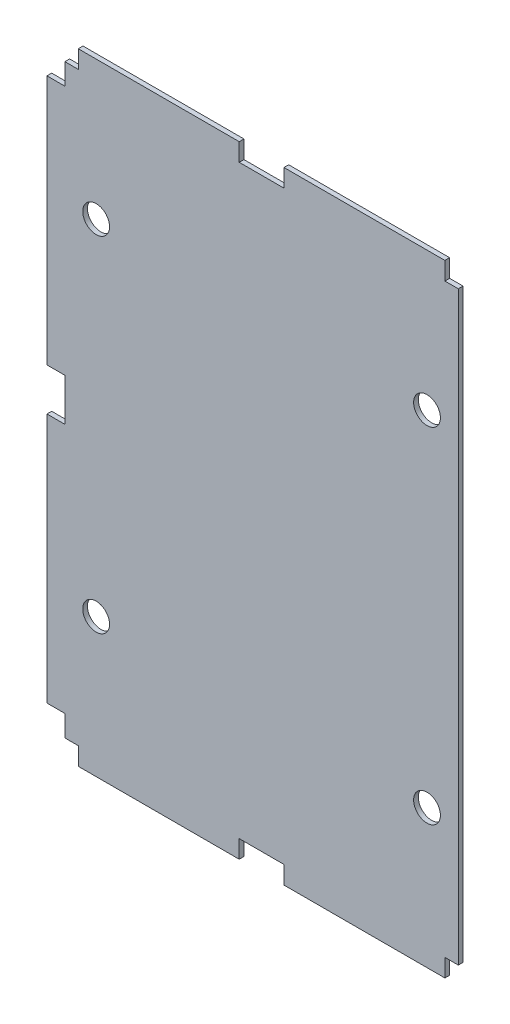
from build123d import *

# Parameters (mm, degrees)
SKETCH1_W           = 279.4
SKETCH1_H           = 415.925
SKETCH1_R           = 9.525
SKETCH1_W_2         = 12.7
SKETCH1_H_2         = 177.8
SKETCH1_W_3         = 114.3
SKETCH1_H_3         = 12.7
BOSS_EXTRUDE3_DEPTH = 3.3528


with BuildPart() as part:
    # Sketch1 → Boss-Extrude3 (new body)
    # profile 1 of 7: a face of its own
    with BuildSketch(Plane.XY):
        Rectangle(SKETCH1_W, SKETCH1_H)
        with Locations((117.475, -122.2375)):
            Circle(SKETCH1_R, mode=Mode.SUBTRACT)
        with Locations((117.475, 122.2375)):
            Circle(SKETCH1_R, mode=Mode.SUBTRACT)
        with Locations((-117.475, -122.2375)):
            Circle(SKETCH1_R, mode=Mode.SUBTRACT)
        with Locations((-117.475, 122.2375)):
            Circle(SKETCH1_R, mode=Mode.SUBTRACT)
    # profile 2 of 7: a face of its own
    with BuildSketch(Plane.XY):
        with Locations((-146.05, 103.98125)):
            Rectangle(SKETCH1_W_2, SKETCH1_H_2)
    # profile 3 of 7: a face of its own
    with BuildSketch(Plane.XY):
        with Locations((-73.025, 214.3125)):
            Rectangle(SKETCH1_W_3, SKETCH1_H_3)
    # profile 4 of 7: a face of its own
    with BuildSketch(Plane.XY):
        with Locations((-146.05, -103.98125)):
            Rectangle(SKETCH1_W_2, SKETCH1_H_2)
    # profile 5 of 7: a face of its own
    with BuildSketch(Plane.XY):
        with Locations((73.025, 214.3125)):
            Rectangle(SKETCH1_W_3, SKETCH1_H_3)
    # profile 6 of 7: a face of its own
    with BuildSketch(Plane.XY):
        with Locations((-73.025, -214.3125)):
            Rectangle(SKETCH1_W_3, SKETCH1_H_3)
    # profile 7 of 7: a face of its own
    with BuildSketch(Plane.XY):
        with Locations((73.025, -214.3125)):
            Rectangle(SKETCH1_W_3, SKETCH1_H_3)
    extrude(amount=BOSS_EXTRUDE3_DEPTH)


solid = part.part
